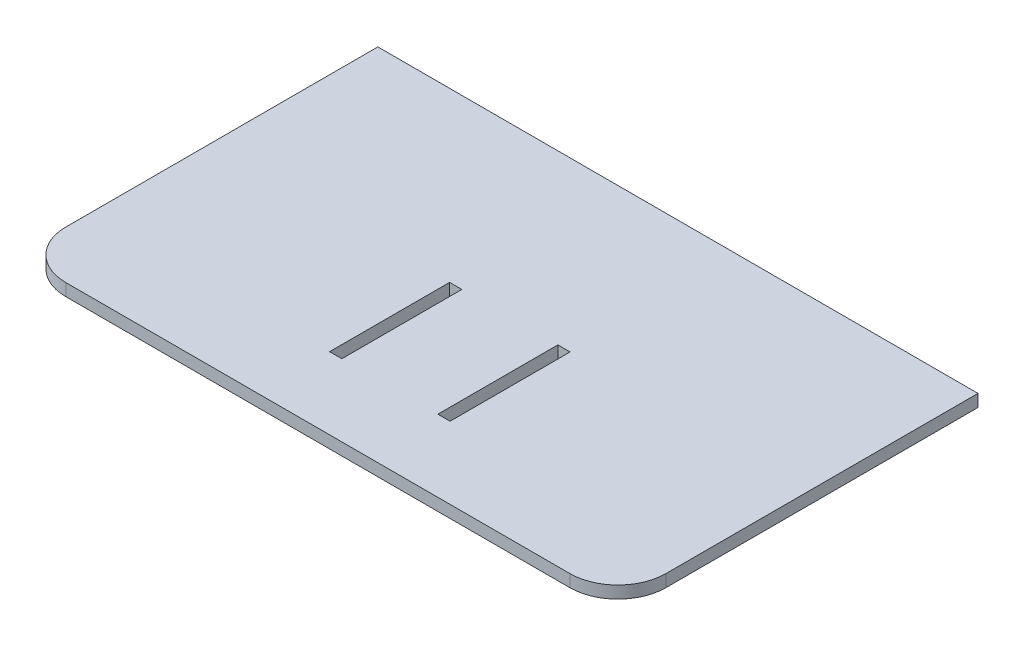
from build123d import *

# Parameters (mm, degrees)
SKETCH1_W           = 5.1
SKETCH1_H           = 50
BOSS_EXTRUDE1_DEPTH = 5.1


with BuildPart() as part:
    # Sketch1 → Boss-Extrude1 (new body)
    with BuildSketch(Plane(origin=(0, 0, 0), x_dir=(1, 0, 0), z_dir=(0, 1, 0))):
        with BuildLine():
            Line((105, -75), (-105, -75))
            ThreePointArc((-105, -75), (-119.142135624, -69.142135624), (-125, -55))
            Line((-125, -55), (-125, 75))
            Line((-125, 75), (125, 75))
            Line((125, 75), (125, -55))
            ThreePointArc((125, -55), (119.142135624, -69.142135624), (105, -75))
        make_face()
        with Locations((-22.55, -20)):
            Rectangle(SKETCH1_W, SKETCH1_H, mode=Mode.SUBTRACT)
        with Locations((22.55, -20)):
            Rectangle(SKETCH1_W, SKETCH1_H, mode=Mode.SUBTRACT)
    extrude(amount=BOSS_EXTRUDE1_DEPTH)


solid = part.part
